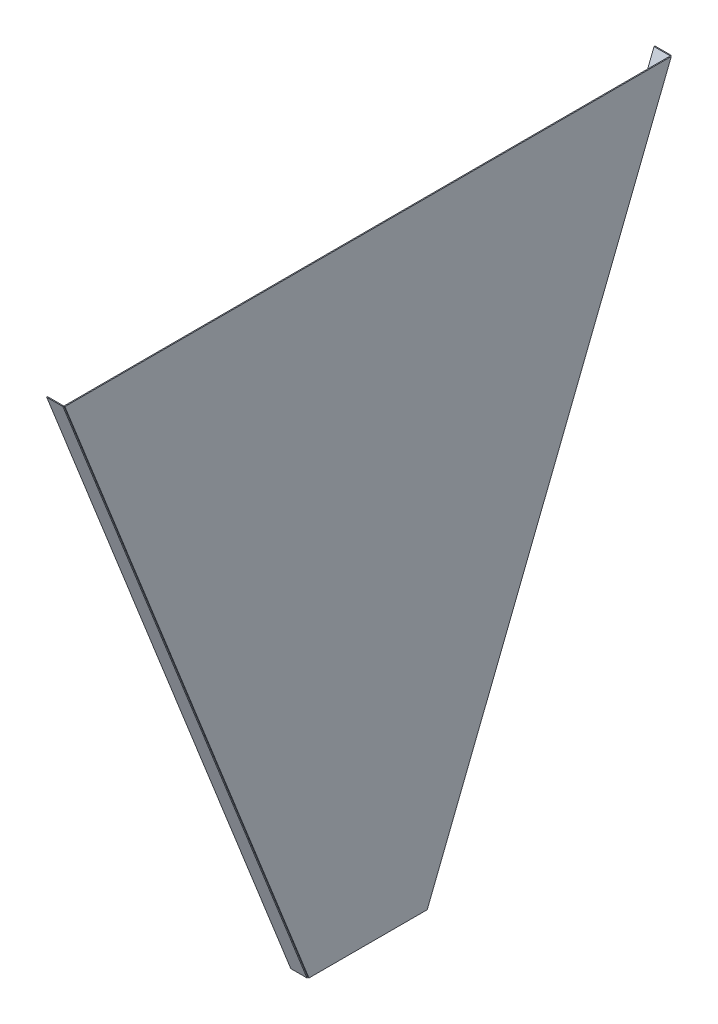
from build123d import *

# Parameters (mm, degrees)
BOSS_EXTRUDE1_DEPTH   = 1.22
BOSS_EXTRUDE2_DEPTH   = 20
BOSS_EXTRUDE2_2_DEPTH = 20


with BuildPart() as part:
    # Sketch1 → Boss-Extrude1 (new body)
    with BuildSketch(Plane(origin=(0, 0, 0), x_dir=(0, 0, -1), z_dir=(1, 0, 0))):
        Polygon((-374.5, 381), (374.5, 381), (73, -381), (0, -381), (-73, -381), align=None)
    extrude(amount=BOSS_EXTRUDE1_DEPTH)


with BuildPart() as body_2:
    # Sketch3 → Boss-Extrude2 (new body)
    with BuildSketch(Plane.ZY):
        Polygon((73, -381), (74.2, -381), (375.7, 381), (374.5, 381), align=None)
    extrude(amount=BOSS_EXTRUDE2_DEPTH)


with BuildPart() as body_3:
    # Sketch3 → Boss-Extrude2 2 (new body)
    with BuildSketch(Plane.ZY):
        Polygon((-73, -381), (-74.2, -381), (-375.7, 381), (-374.5, 381), align=None)
    extrude(amount=BOSS_EXTRUDE2_2_DEPTH)


solid = Compound([part.part, body_2.part, body_3.part])
